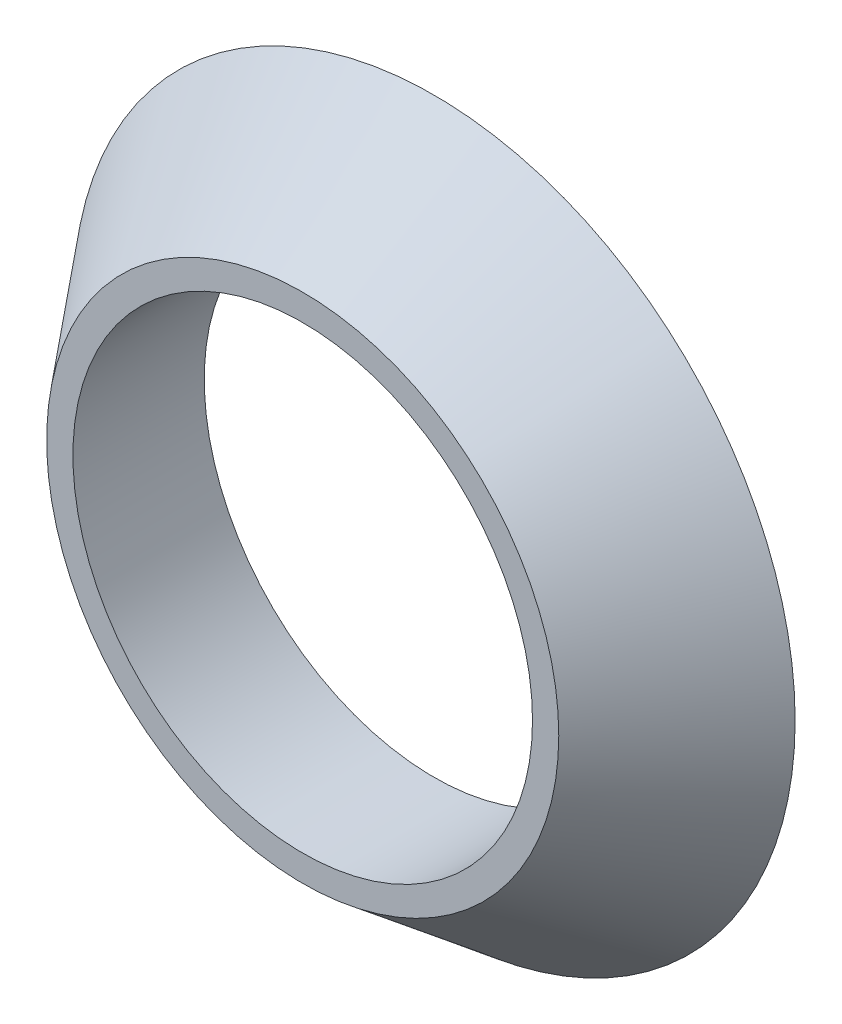
from build123d import *


with BuildPart() as part:
    # Sketch1 → Revolve1 (revolve)
    with BuildSketch(Plane(origin=(0, 0, 0), x_dir=(0, 0, -1), z_dir=(1, 0, 0)), mode=Mode.PRIVATE) as revolve1_sk:
        Polygon((26.12752284, 22.225), (38.82752284, 22.225), (38.82752284, 34.925), (26.12752284, 24.765), align=None)
    revolve(revolve1_sk.sketch.rotate(Axis((0, 0, 0), (0, 0, -1)), 90), axis=Axis((0, 0, 0), (0, 0, -1)))


solid = part.part
